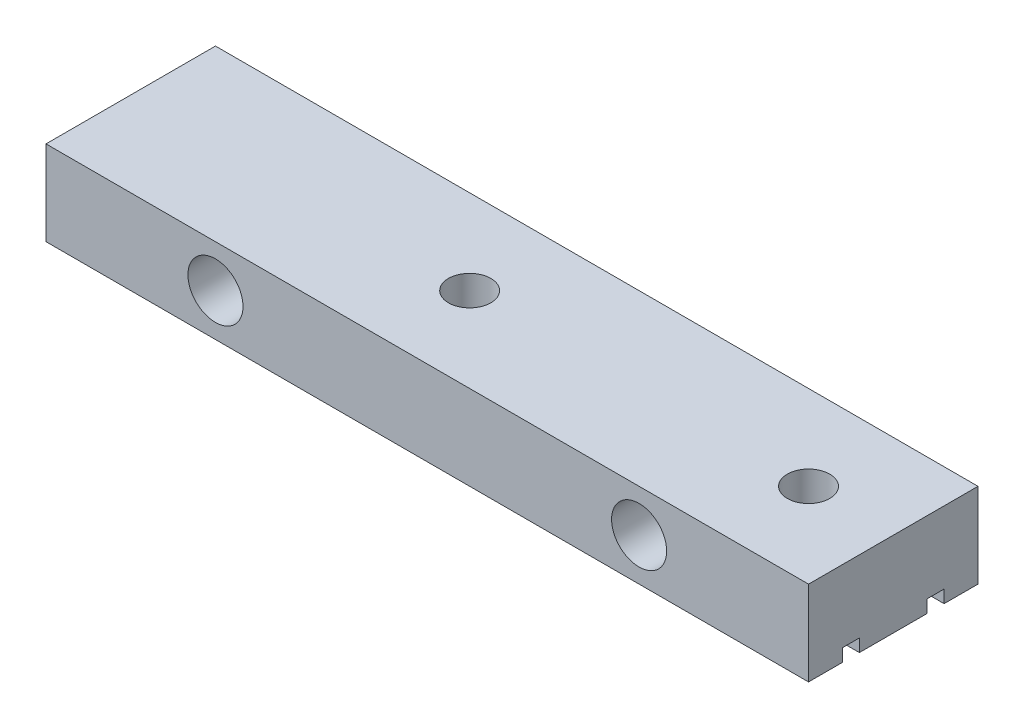
from build123d import *

# Parameters (mm, degrees)
IZIM1_W                          = 90
IZIM1_H                          = 10
Y_KSEKLIK_EKSTR_ZYON1_DEPTH      = 20
IZIM6_W                          = 2
IZIM6_H                          = 1.5
KES_EKSTR_ZYON1_DEPTH            = 93.736184955
F_4_0MM_SAPLAMA_DELIKLERI3_D     = 5
F_4_0MM_SAPLAMA_DELIKLERI3_DEPTH = 8
IZIM14_R                         = 2
KES_EKSTR_ZYON2_DEPTH            = 93.736184955
IZIM13_R                         = 3.25
KES_EKSTR_ZYON4_DEPTH            = 6
KES_EKSTR_ZYON5_START            = -6
IZIM15_R                         = 3.25
KES_EKSTR_ZYON5_DEPTH            = 6


with BuildPart() as part:
    # Çizim1 → Yükseklik-Ekstrüzyon1 (new body)
    with BuildSketch(Plane.XY):
        with Locations((45, 5)):
            Rectangle(IZIM1_W, IZIM1_H)
    extrude(amount=Y_KSEKLIK_EKSTR_ZYON1_DEPTH)

    # Çizim6 → Kes-Ekstrüzyon1 (cut, through all)
    with BuildSketch(Plane.ZY):
        with Locations((5, 0.75)):
            Rectangle(IZIM6_W, IZIM6_H)
        with Locations((15, 0.75)):
            Rectangle(IZIM6_W, IZIM6_H)
    extrude(amount=-KES_EKSTR_ZYON1_DEPTH, mode=Mode.SUBTRACT)

    # Ø4.0mm Saplama Delikleri3
    with Locations(Plane(origin=(40, 10, 10), x_dir=(0, 0, 1), z_dir=(0, 1, 0))):
        with Locations((0, 0), (0, 40)):
            Hole(F_4_0MM_SAPLAMA_DELIKLERI3_D / 2, depth=F_4_0MM_SAPLAMA_DELIKLERI3_DEPTH)

    # Çizim14 → Kes-Ekstrüzyon2 (cut, through all)
    with BuildSketch(Plane.XY.offset(20)):
        with Locations((20, 5)):
            Circle(IZIM14_R)
        with Locations((70, 5)):
            Circle(IZIM14_R)
    extrude(amount=-KES_EKSTR_ZYON2_DEPTH, mode=Mode.SUBTRACT)

    # Çizim13 → Kes-Ekstrüzyon4 (cut)
    with BuildSketch(Plane.XY.offset(20)):
        with Locations((20, 5)):
            Circle(IZIM13_R)
        with Locations((70, 5)):
            Circle(IZIM13_R)
    extrude(amount=-KES_EKSTR_ZYON4_DEPTH, mode=Mode.SUBTRACT)

    # Çizim15 → Kes-Ekstrüzyon5 (cut)
    with BuildSketch(Plane(origin=(0, 0, 0), x_dir=(-1, 0, 0), z_dir=(0, 0, -1)).offset(KES_EKSTR_ZYON5_START)):
        with Locations(Location((-70, 5, 0), (0, 0, 180))):
            Circle(IZIM15_R)
        with Locations(Location((-20, 5, 0), (0, 0, 180))):
            Circle(IZIM15_R)
    extrude(amount=KES_EKSTR_ZYON5_DEPTH, mode=Mode.SUBTRACT)


solid = part.part
